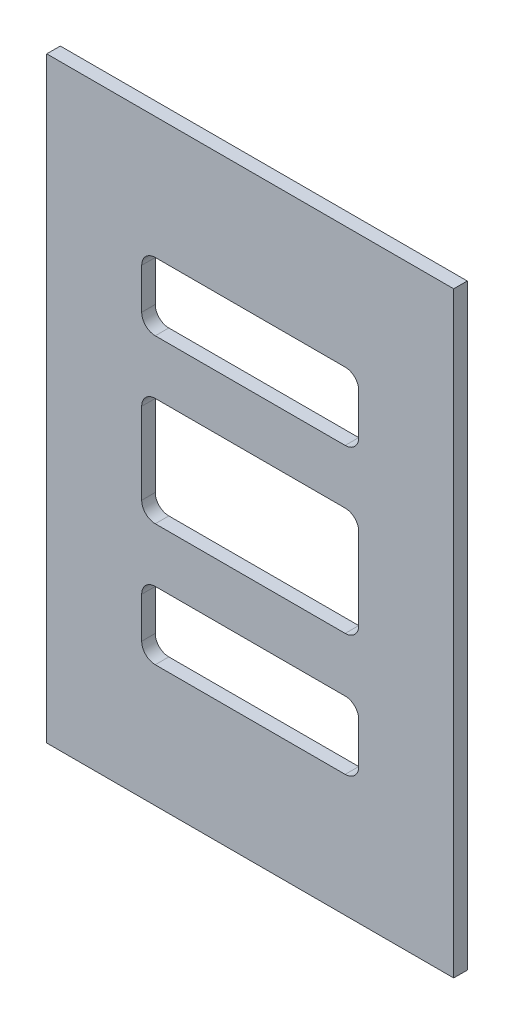
from build123d import *

# Parameters (mm, degrees)
SKETCH1_W           = 30
SKETCH1_H           = 44
BOSS_EXTRUDE2_DEPTH = 1


with BuildPart() as part:
    # Sketch1 → Boss-Extrude2 (new body)
    with BuildSketch(Plane.XY):
        Rectangle(SKETCH1_W, SKETCH1_H)
        with BuildLine():
            Line((-7, 8), (7, 8))
            ThreePointArc((7, 8), (7.707106781, 8.292893219), (8, 9))
            Line((8, 9), (8, 12))
            ThreePointArc((8, 12), (7.707106781, 12.707106781), (7, 13))
            Line((7, 13), (-7, 13))
            ThreePointArc((-7, 13), (-7.707106781, 12.707106781), (-8, 12))
            Line((-8, 12), (-8, 9))
            ThreePointArc((-8, 9), (-7.707106781, 8.292893219), (-7, 8))
        make_face(mode=Mode.SUBTRACT)
        with BuildLine():
            Line((-7, -4), (7, -4))
            ThreePointArc((7, -4), (7.707106781, -3.707106781), (8, -3))
            Line((8, -3), (8, 3))
            ThreePointArc((8, 3), (7.707106781, 3.707106781), (7, 4))
            Line((7, 4), (-7, 4))
            ThreePointArc((-7, 4), (-7.707106781, 3.707106781), (-8, 3))
            Line((-8, 3), (-8, -3))
            ThreePointArc((-8, -3), (-7.707106781, -3.707106781), (-7, -4))
        make_face(mode=Mode.SUBTRACT)
        with BuildLine():
            Line((-7, -13), (7, -13))
            ThreePointArc((7, -13), (7.707106781, -12.707106781), (8, -12))
            Line((8, -12), (8, -9))
            ThreePointArc((8, -9), (7.707106781, -8.292893219), (7, -8))
            Line((7, -8), (-7, -8))
            ThreePointArc((-7, -8), (-7.707106781, -8.292893219), (-8, -9))
            Line((-8, -9), (-8, -12))
            ThreePointArc((-8, -12), (-7.707106781, -12.707106781), (-7, -13))
        make_face(mode=Mode.SUBTRACT)
    extrude(amount=BOSS_EXTRUDE2_DEPTH)


solid = part.part
